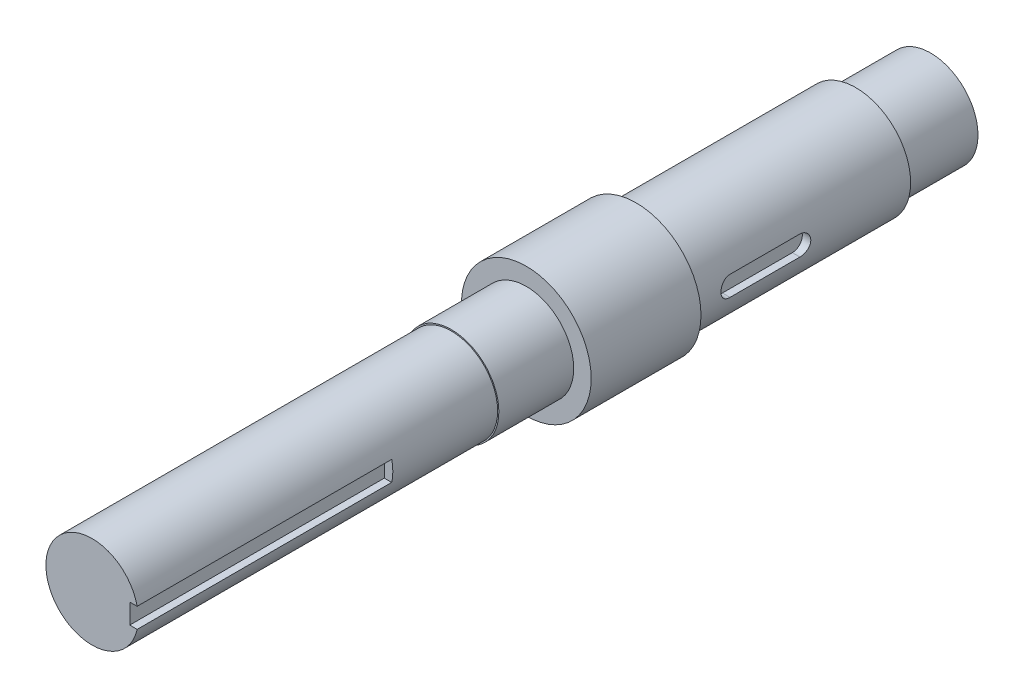
from build123d import *

# Parameters (mm, degrees)
SKETCH3_W          = 4.079746654
SKETCH3_H          = 4
CUT_EXTRUDE1_DEPTH = 51
CUT_EXTRUDE2_START = 11
CUT_EXTRUDE2_DEPTH = 1.7


with BuildPart() as part:
    # Sketch2 → Revolve1 (revolve)
    with BuildSketch(Plane(origin=(0, 0, 0), x_dir=(1, 0, 0), z_dir=(0, 1, 0)), mode=Mode.PRIVATE) as revolve1_sk:
        Polygon((0, 0), (-9.25, 0), (-9.25, 72), (-9.5, 72), (-9.5, 87), (-13, 87), (-13, 109), (-11, 109), (-11, 153), (-9.5, 153), (-9.5, 168), (0, 168), align=None)
    revolve(revolve1_sk.sketch.rotate(Axis((0, 0, 0), (0, 0, -1)), 180), axis=Axis((0, 0, 0), (0, 0, -1)))

    # Sketch3 → Cut-Extrude1 (cut)
    with BuildSketch(Plane.XY):
        with Locations((9.589873327, 0)):
            Rectangle(SKETCH3_W, SKETCH3_H)
    extrude(amount=-CUT_EXTRUDE1_DEPTH, mode=Mode.SUBTRACT)

    # Sketch4 → Cut-Extrude2 (cut)
    with BuildSketch(Plane(origin=(0, 0, 0), x_dir=(0, 0, -1), z_dir=(1, 0, 0)).offset(CUT_EXTRUDE2_START)):
        with BuildLine():
            Line((117, 2), (131, 2))
            ThreePointArc((131, 2), (133, 0), (131, -2))
            Line((131, -2), (117, -2))
            ThreePointArc((117, -2), (115, 0), (117, 2))
        make_face()
    extrude(amount=-CUT_EXTRUDE2_DEPTH, mode=Mode.SUBTRACT)


solid = part.part
